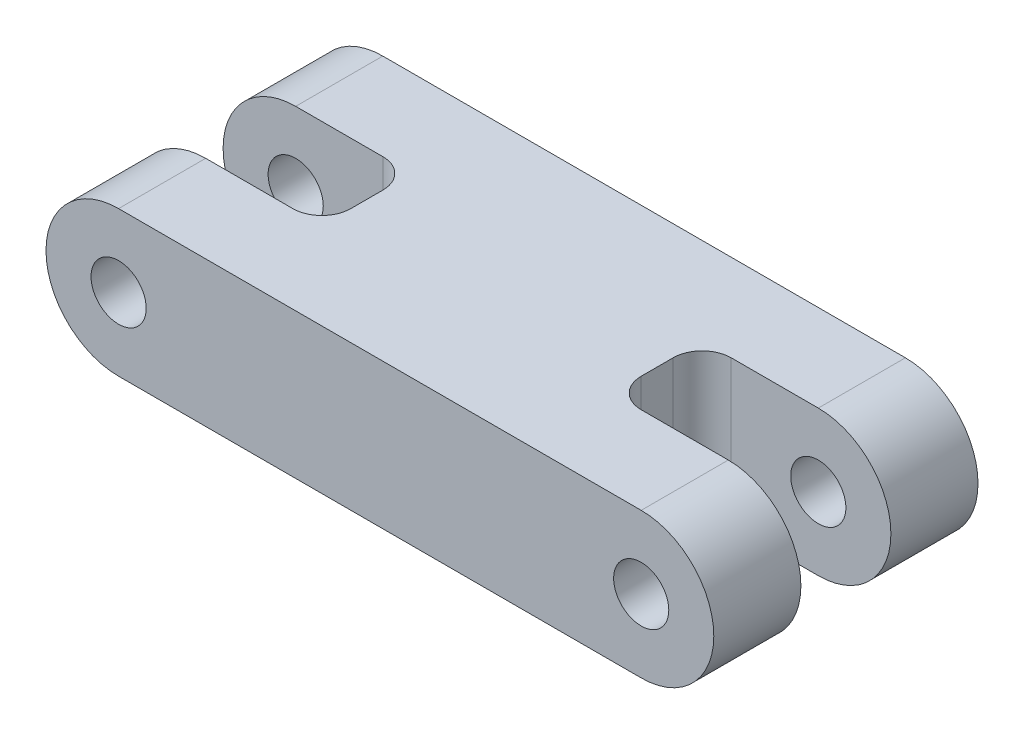
from build123d import *

# Parameters (mm, degrees)
EXTRUDE_START       = -9.1
EXTRUDE_1_DEPTH     = 6
SKETCH_5_R          = 1.9
CUT_EXTRUDE_5_DEPTH = 42.737273509
SKETCH_6_R          = 1.9
CUT_EXTRUDE_6_DEPTH = 10
SKETCH_7_W          = 20
SKETCH_7_H          = 10
EXTRUDE_2_DEPTH     = 3.1
FILLET_1_R          = 2


with BuildPart() as part:
    # ｽｹｯﾁ1 → ﾎﾞｽ - 押し出し1 (new body)
    with BuildSketch(Plane.XY.offset(EXTRUDE_START)):
        with BuildLine():
            Line((0, 5), (-36, 5))
            ThreePointArc((-36, 5), (-41, 0), (-36, -5))
            Line((-36, -5), (0, -5))
            ThreePointArc((0, -5), (5, 0), (0, 5))
        make_face()
    extrude_1 = extrude(amount=EXTRUDE_1_DEPTH)

    # ｽｹｯﾁ5 → ｶｯﾄ - 押し出し5 (cut, through all)
    with BuildSketch(Plane.XY.offset(-3.1)):
        with Locations((-36, 0)):
            Circle(SKETCH_5_R)
    cut_extrude_5 = extrude(amount=-CUT_EXTRUDE_5_DEPTH, mode=Mode.SUBTRACT)

    # ｽｹｯﾁ6 → ｶｯﾄ - 押し出し6 (cut)
    with BuildSketch(Plane.XY.offset(-3.1)):
        Circle(SKETCH_6_R)
    cut_extrude_6 = extrude(amount=-CUT_EXTRUDE_6_DEPTH, mode=Mode.SUBTRACT)

    # ｽｹｯﾁ7 → ﾎﾞｽ - 押し出し2 (add)
    with BuildSketch(Plane.XY.offset(-3.1)):
        with Locations((-18, 0)):
            Rectangle(SKETCH_7_W, SKETCH_7_H)
    extrude_2 = extrude(amount=EXTRUDE_2_DEPTH)

    # ﾐﾗｰ3: ﾎﾞｽ - 押し出し1, ｶｯﾄ - 押し出し5, ｶｯﾄ - 押し出し6, ﾎﾞｽ - 押し出し2 across plane
    add(extrude_1.mirror(Plane.XY))
    add(cut_extrude_5.mirror(Plane.XY), mode=Mode.SUBTRACT)
    add(cut_extrude_6.mirror(Plane.XY), mode=Mode.SUBTRACT)
    add(extrude_2.mirror(Plane.XY))

    # ﾌｨﾚｯﾄ1
    fillet_1_edges = [part.edges().sort_by_distance(p)[0] for p in [
        (-8, 0, -3.1),
        (-28, 0, -3.1),
        (-8, 0, 3.1),
        (-28, 0, 3.1),
    ]]
    fillet(fillet_1_edges, radius=FILLET_1_R)


solid = part.part
